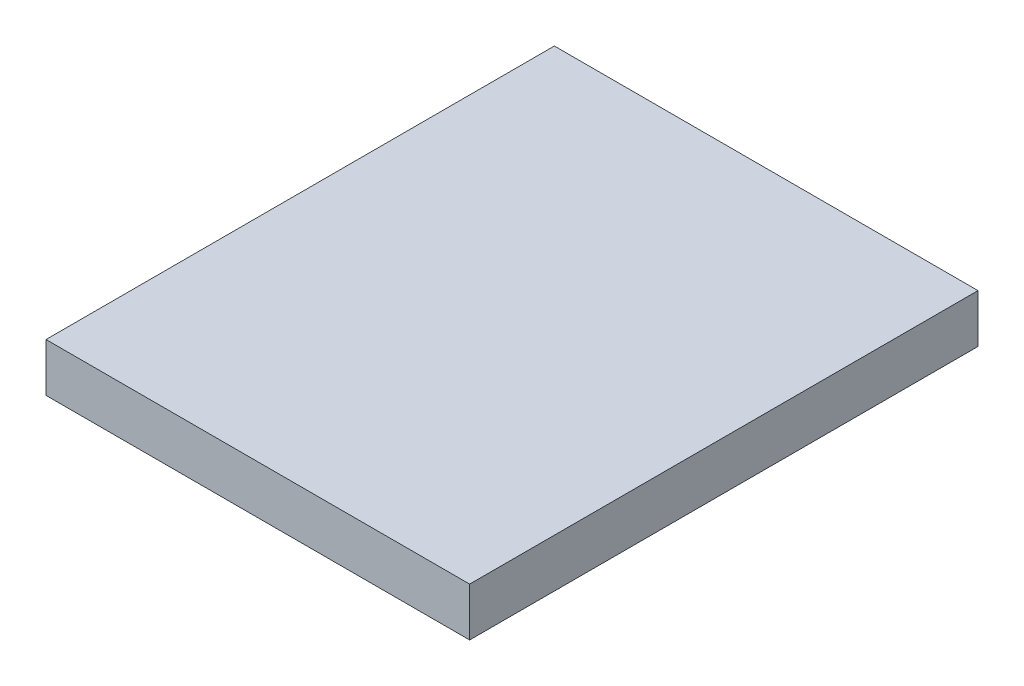
from build123d import *

# Parameters (mm, degrees)
SKETCH1_W           = 35
SKETCH1_H           = 42
BOSS_EXTRUDE1_DEPTH = 4


with BuildPart() as part:
    # Sketch1 → Boss-Extrude1 (new body)
    with BuildSketch(Plane(origin=(0, 0, 0), x_dir=(1, 0, 0), z_dir=(0, 1, 0))):
        with Locations((17.5, 21)):
            Rectangle(SKETCH1_W, SKETCH1_H)
    extrude(amount=BOSS_EXTRUDE1_DEPTH)


solid = part.part
